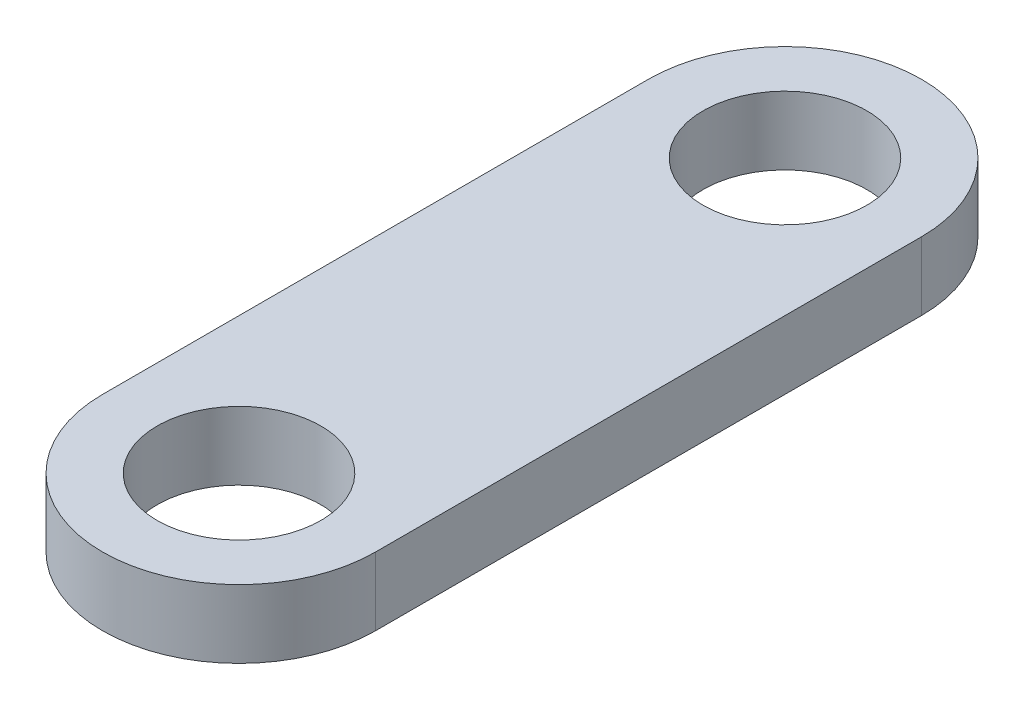
from build123d import *

# Parameters (mm, degrees)
SKETCH1_R           = 3.6
BOSS_EXTRUDE1_DEPTH = 3


with BuildPart() as part:
    # Sketch1 → Boss-Extrude1 (new body)
    with BuildSketch(Plane(origin=(0, 0, 0), x_dir=(1, 0, 0), z_dir=(0, 1, 0))):
        with BuildLine():
            Line((6, 0), (6, -24))
            ThreePointArc((6, -24), (0, -30), (-6, -24))
            Line((-6, -24), (-6, 0))
            ThreePointArc((-6, 0), (0, 6), (6, 0))
        make_face()
        with Locations(Location((0, 0, 0), (0, 0, 270))):
            Circle(SKETCH1_R, mode=Mode.SUBTRACT)
        with Locations(Location((0, -24, 0), (0, 0, 270))):
            Circle(SKETCH1_R, mode=Mode.SUBTRACT)
    extrude(amount=BOSS_EXTRUDE1_DEPTH)


solid = part.part
